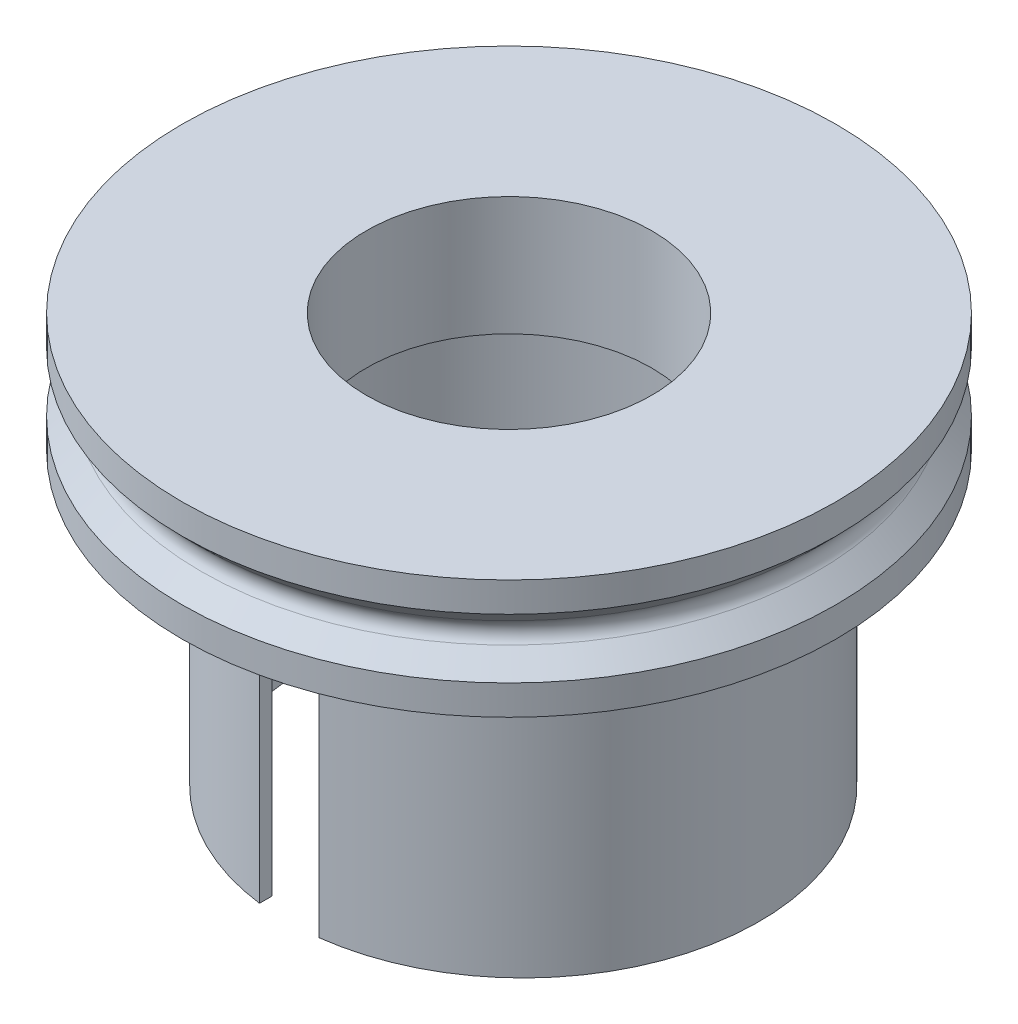
from build123d import *

# Parameters (mm, degrees)
SKETCH1_R           = 12.6
SKETCH1_R_2         = 11.176
BOSS_EXTRUDE1_DEPTH = 15.875
SKETCH2_R           = 17.4625
SKETCH2_R_2         = 7.62
BOSS_EXTRUDE2_DEPTH = 6.35
SKETCH4_W           = 3.175
SKETCH4_H           = 15.94800196
CUT_EXTRUDE1_DEPTH  = 15.875


with BuildPart() as part:
    # Sketch1 → Boss-Extrude1 (new body)
    with BuildSketch(Plane(origin=(0, 0, 0), x_dir=(1, 0, 0), z_dir=(0, 1, 0))):
        with Locations(Location((0, 0.762, 0), (0, 0, 270))):
            Circle(SKETCH1_R)
        with Locations(Location((0, 0, 0), (0, 0, 270))):
            Circle(SKETCH1_R_2, mode=Mode.SUBTRACT)
    extrude(amount=BOSS_EXTRUDE1_DEPTH)

    # Sketch2 → Boss-Extrude2 (add)
    with BuildSketch(Plane(origin=(0, 15.875, 0), x_dir=(1, 0, 0), z_dir=(0, 1, 0))):
        with Locations(Location((0, 0, 0), (0, 0, 270))):
            Circle(SKETCH2_R)
        with Locations(Location((0, 0, 0), (0, 0, 270))):
            Circle(SKETCH2_R_2, mode=Mode.SUBTRACT)
    extrude(amount=BOSS_EXTRUDE2_DEPTH)

    # Sketch3 → Cut-Revolve1 (revolve, cut)
    with BuildSketch(Plane.XY, mode=Mode.PRIVATE) as cut_revolve1_sk:
        with BuildLine():
            Line((-17.4625, 20.6375), (-16.436266008, 19.611266008))
            ThreePointArc((-16.436266008, 19.611266008), (-16.203782015, 19.05), (-16.436266008, 18.488733992))
            Line((-16.436266008, 18.488733992), (-17.4625, 17.4625))
            Line((-17.4625, 17.4625), (-17.4625, 20.6375))
        make_face()
    revolve(cut_revolve1_sk.sketch.rotate(Axis((0, 22.225, 0), (0, -1, 0)), 270), axis=Axis((0, 22.225, 0), (0, -1, 0)), mode=Mode.SUBTRACT)

    # Sketch4 → Cut-Extrude1 (cut)
    with BuildSketch(Plane.XZ):
        with Locations((0, 11.838)):
            Rectangle(SKETCH4_W, SKETCH4_H)
    extrude(amount=-CUT_EXTRUDE1_DEPTH, mode=Mode.SUBTRACT)


solid = part.part
